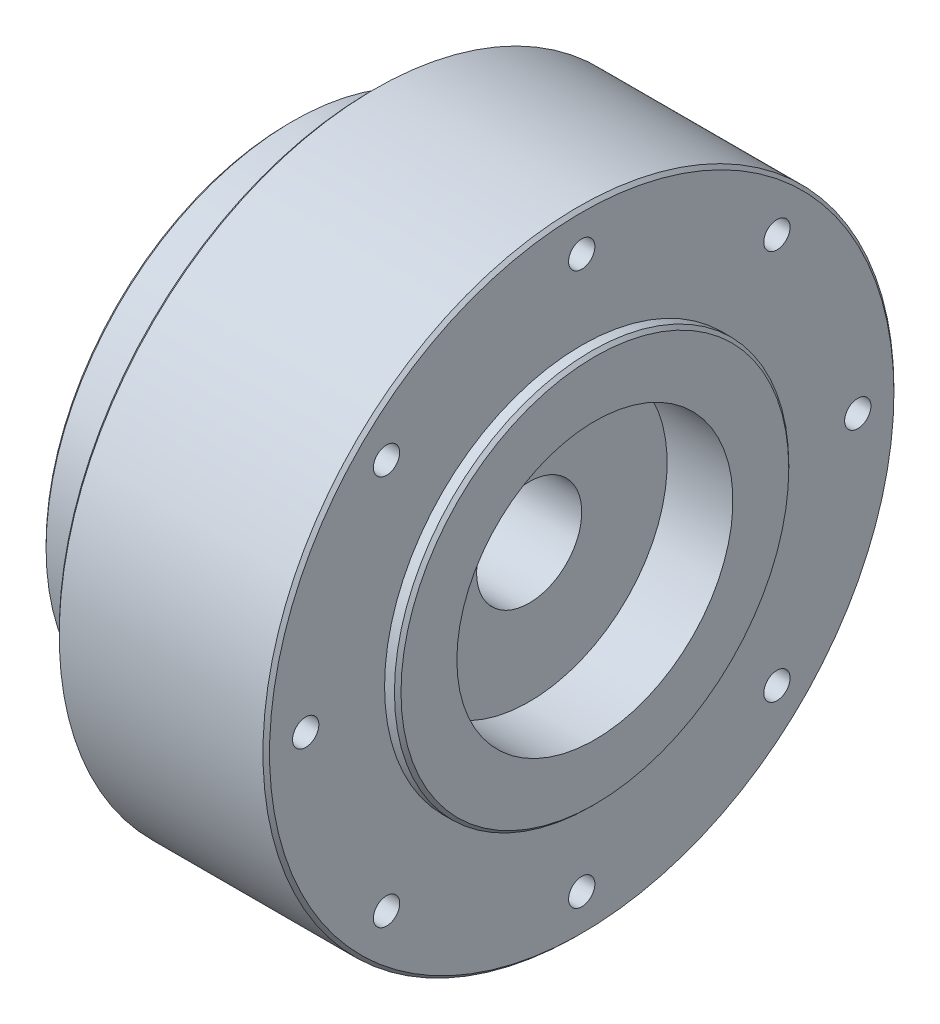
from build123d import *

# Parameters (mm, degrees)
SKETCH3_R          = 2
CUT_EXTRUDE1_DEPTH = 32
CIRPATTERN1_COUNT  = 8
CHAMFER1_SIZE      = 0.5
CHAMFER2_SIZE      = 0.5


with BuildPart() as part:
    # Sketch2 → Revolve1 (revolve)
    with BuildSketch(Plane(origin=(0, 0, 0), x_dir=(1, 0, 0), z_dir=(0, 1, 0)), mode=Mode.PRIVATE) as revolve1_sk:
        Polygon((0, 30), (0, 48), (-32, 48), (-32, 37.5), (-44.5, 37.5), (-44.5, 0), (-42.5, 0), (-42.5, 11), (-36.5, 11), (-36.5, 8), (-8, 8), (-8, 21), (2, 21), (2, 30), align=None)
    revolve(revolve1_sk.sketch.rotate(Axis((-32, 0, 0), (1, 0, 0)), 180), axis=Axis((-32, 0, 0), (1, 0, 0)))

    # Sketch3 → Cut-Extrude1 (cut)
    with BuildSketch(Plane.ZY.offset(32)):
        with Locations((0, 42)):
            Circle(SKETCH3_R)
    cut_extrude1 = extrude(amount=-CUT_EXTRUDE1_DEPTH, mode=Mode.SUBTRACT)

    # CirPattern1: Cut-Extrude1 ×8 about axis
    cirpattern1_axis = Axis((0, 0, 0), (1, 0, 0))
    for i in range(1, CIRPATTERN1_COUNT):
        add(cut_extrude1.rotate(cirpattern1_axis, i * 360 / CIRPATTERN1_COUNT), mode=Mode.SUBTRACT)

    # Chamfer1
    chamfer1_edges = [part.edges().sort_by_distance(p)[0] for p in [
        (-44.5, 0, -37.5),
        (-32, 0, -48),
        (0, 0, -48),
    ]]
    chamfer(chamfer1_edges, length=CHAMFER1_SIZE)

    # Chamfer2
    chamfer2_edges = [part.edges().sort_by_distance(p)[0] for p in [
        (2, 0, -30),
    ]]
    chamfer(chamfer2_edges, length=CHAMFER2_SIZE)


solid = part.part
